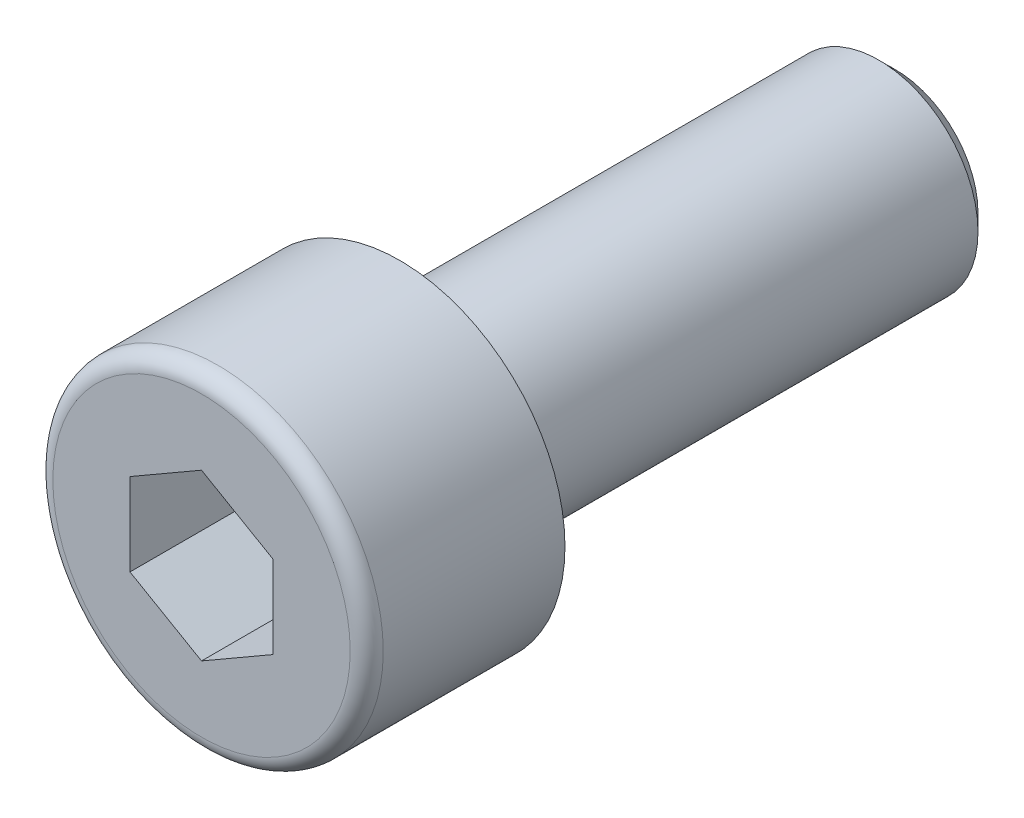
from build123d import *

# Parameters (mm, degrees)
ESQUISSE1_R             = 3
BASE_EXTRUSION_DEPTH    = 21
CHANFREIN1_SIZE         = 0.5
ESQUISSE2_R             = 5
BOSS_EXTRU_1_DEPTH      = 6
ENL_V_MAT_EXTRU_1_DEPTH = 3.5
CONG_2_R                = 0.5


with BuildPart() as part:
    # Esquisse1 → Base-Extrusion (new body)
    with BuildSketch(Plane.XY):
        Circle(ESQUISSE1_R)
    extrude(amount=BASE_EXTRUSION_DEPTH)

    # Chanfrein1
    chanfrein1_edges = [part.edges().sort_by_distance(p)[0] for p in [
        (-3, 0, 0),
    ]]
    chamfer(chanfrein1_edges, length=CHANFREIN1_SIZE)

    # Esquisse2 → Boss.-Extru.1 (add)
    with BuildSketch(Plane.XY.offset(15)):
        Circle(ESQUISSE2_R)
    extrude(amount=BOSS_EXTRU_1_DEPTH)

    # Esquisse3 → Enlèv. mat.-Extru.1 (cut)
    with BuildSketch(Plane.XY.offset(21)):
        Polygon((0, 2.5), (-2.165063509, 1.25), (-2.165063509, -1.25), (0, -2.5), (2.165063509, -1.25), (2.165063509, 1.25), align=None)
    extrude(amount=-ENL_V_MAT_EXTRU_1_DEPTH, mode=Mode.SUBTRACT)

    # Congé2
    cong_2_edges = [part.edges().sort_by_distance(p)[0] for p in [
        (-5, 0, 21),
    ]]
    fillet(cong_2_edges, radius=CONG_2_R)


solid = part.part
